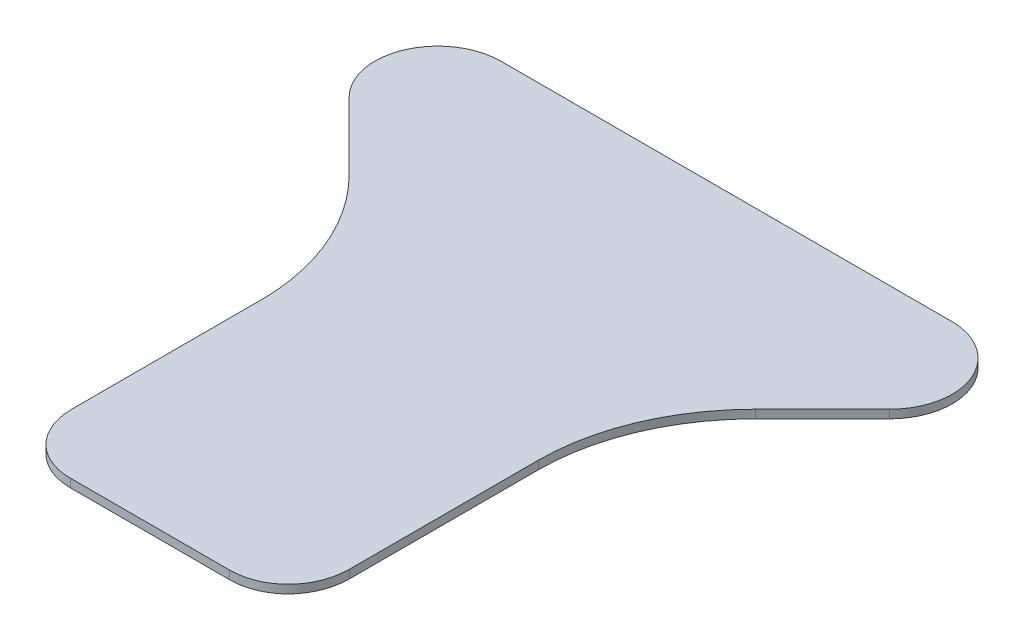
from build123d import *

# Parameters (mm, degrees)
BOSS_EXTRUDE1_DEPTH = 2


with BuildPart() as part:
    # Sketch2 → Boss-Extrude1 (new body)
    with BuildSketch(Plane(origin=(0, 0, 0), x_dir=(1, 0, 0), z_dir=(0, 1, 0))):
        with BuildLine():
            Line((33.126933041, -63.09374476), (33.126933041, -18.054684141))
            add(Edge.make_bspline(
                [(48.502275197, 18.403994452), (33.126933041, 3.028652296), (33.126933041, -18.054684141)],
                knots=[1.874843142, 1.874843142, 1.874843142, 2.666072932, 2.666072932, 2.666072932], degree=2, weights=[1, 0.922759773, 1]))
            Line((48.502275197, 18.403994452), (64.532040349, 34.433759604))
            add(Edge.make_bspline(
                [(64.532040349, 34.433759604), (90.098280745, 60), (53.804046318, 60)],
                knots=[2.359992588, 2.359992588, 2.359992588, 4.71238898, 4.71238898, 4.71238898], degree=2, weights=[1, 0.384437234, 1]))
            Line((53.804046318, 60), (-53.804046318, 60))
            add(Edge.make_bspline(
                [(-53.804046318, 60), (-90.098280745, 60), (-64.532040349, 34.433759604)],
                knots=[1.570796327, 1.570796327, 1.570796327, 3.923192719, 3.923192719, 3.923192719], degree=2, weights=[1, 0.384437234, 1]))
            Line((-64.532040349, 34.433759604), (-48.502275197, 18.403994452))
            add(Edge.make_bspline(
                [(-33.126933041, -18.054684141), (-33.126933041, 3.028652296), (-48.502275197, 18.403994452)],
                knots=[3.617112375, 3.617112375, 3.617112375, 4.408342165, 4.408342165, 4.408342165], degree=2, weights=[1, 0.922759773, 1]))
            Line((-33.126933041, -18.054684141), (-33.126933041, -63.09374476))
            add(Edge.make_bspline(
                [(-33.126933041, -63.09374476), (-33.126933041, -77.64337492), (-18.972450653, -77.64337492)],
                knots=[2.250325805, 2.250325805, 2.250325805, 3.732484786, 3.732484786, 3.732484786], degree=2, weights=[1, 0.737740241, 1]))
            Line((-18.972450653, -77.64337492), (18.972450653, -77.64337492))
            add(Edge.make_bspline(
                [(18.972450653, -77.64337492), (33.126933041, -77.64337492), (33.126933041, -63.09374476)],
                knots=[5.692293175, 5.692293175, 5.692293175, 7.174452156, 7.174452156, 7.174452156], degree=2, weights=[1, 0.737740241, 1]))
        make_face()
    extrude(amount=-BOSS_EXTRUDE1_DEPTH)


solid = part.part
